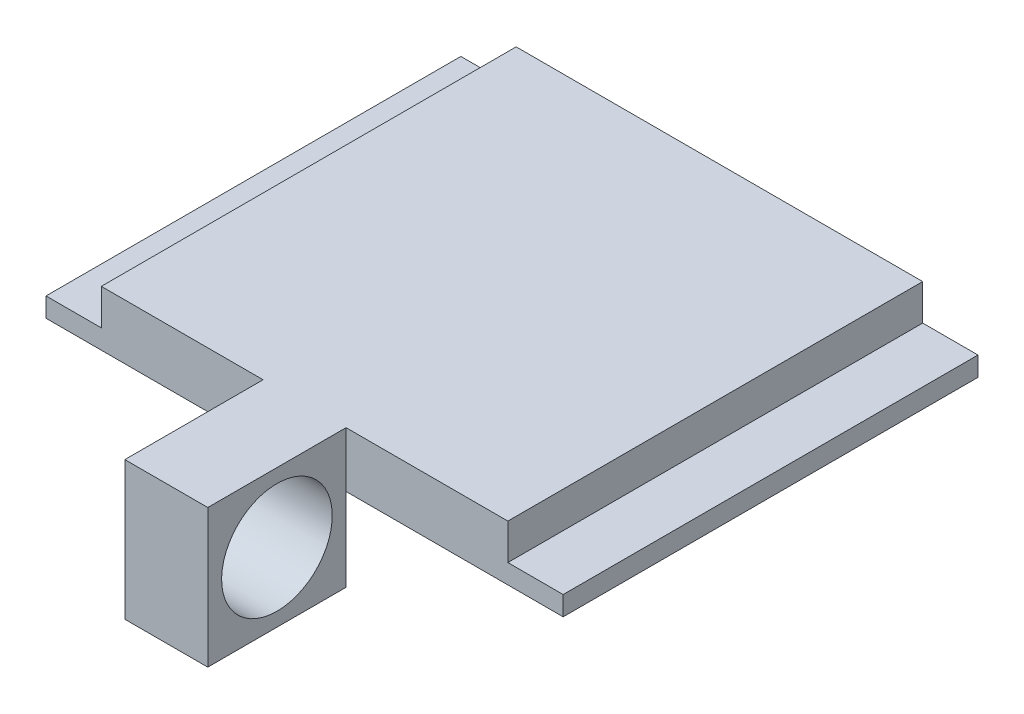
from build123d import *

# Parameters (mm, degrees)
BOSS_EXTRUDE1_DEPTH = 15
SKETCH2_W           = 3
SKETCH2_H           = 1.5
SKETCH2_W_2         = 1.5
SKETCH2_H_2         = 2
BOSS_EXTRUDE3_DEPTH = 5
SKETCH4_R           = 2
CUT_EXTRUDE1_DEPTH  = 3


with BuildPart() as part:
    # Sketch1 → Boss-Extrude1 (new body)
    with BuildSketch(Plane.XY):
        Polygon((7.5, -0.65), (9.35, -0.65), (9.35, -1.35), (-9.35, -1.35), (-9.35, -0.65), (-7.5, -0.65), (-7.35, -0.65), (-7.35, -0.5), (-7.35, 0.35), (-7.35, 0.65), (7.35, 0.65), (7.35, 0.35), (7.35, -0.5), (7.35, -0.65), align=None)
    extrude(amount=-BOSS_EXTRUDE1_DEPTH)

    # Sketch2 → Boss-Extrude3 (add)
    with BuildSketch(Plane.XY):
        with Locations((0, -3.6)):
            Rectangle(SKETCH2_W, SKETCH2_H)
        Polygon((1.5, -1.35), (0, -1.35), (-1.5, -1.35), (-1.5, -2.85), (1.5, -2.85), align=None)
        with Locations((-0.75, -0.35)):
            Rectangle(SKETCH2_W_2, SKETCH2_H_2)
        with Locations((0.75, -0.35)):
            Rectangle(SKETCH2_W_2, SKETCH2_H_2)
    extrude(amount=BOSS_EXTRUDE3_DEPTH)

    # Sketch4 → Cut-Extrude1 (cut)
    with BuildSketch(Plane.ZY.offset(1.5)):
        with Locations(Location((2.5, -1.85, 0), (0, 0, 270))):
            Circle(SKETCH4_R)
    extrude(amount=-CUT_EXTRUDE1_DEPTH, mode=Mode.SUBTRACT)


solid = part.part
